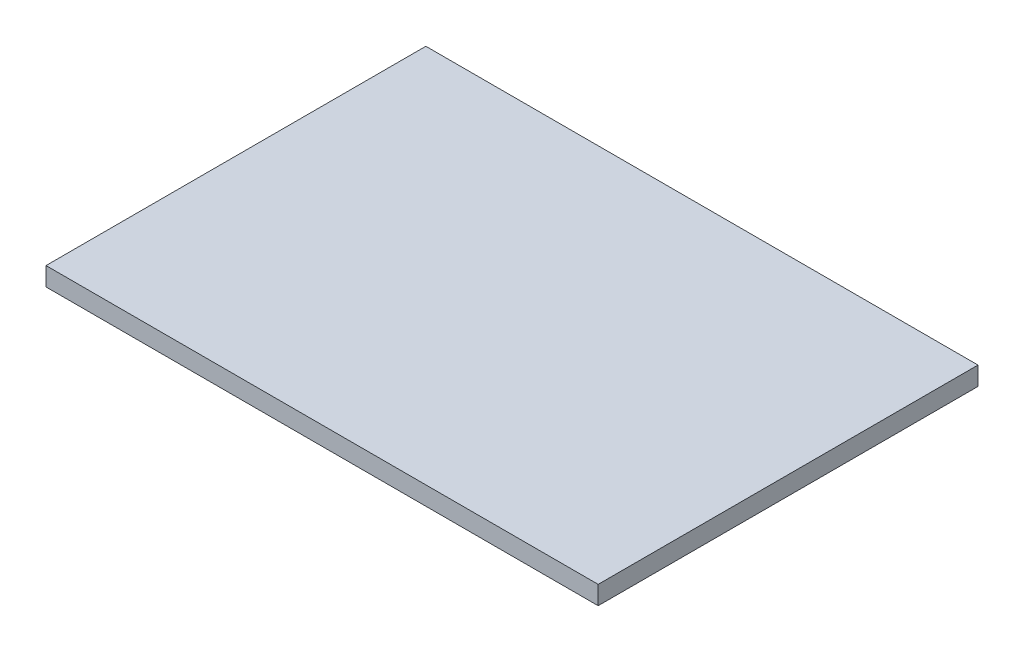
from build123d import *

# Parameters (mm, degrees)
SKETCH_1_W        = 596
SKETCH_1_H        = 410
EXTRUDE_251_DEPTH = 20


with BuildPart() as part:
    # Эскиз1 → Extrude 251 (new body)
    with BuildSketch(Plane(origin=(0, 0, 0), x_dir=(1, 0, 0), z_dir=(0, 1, 0))):
        Rectangle(SKETCH_1_W, SKETCH_1_H)
    extrude(amount=EXTRUDE_251_DEPTH)


solid = part.part
